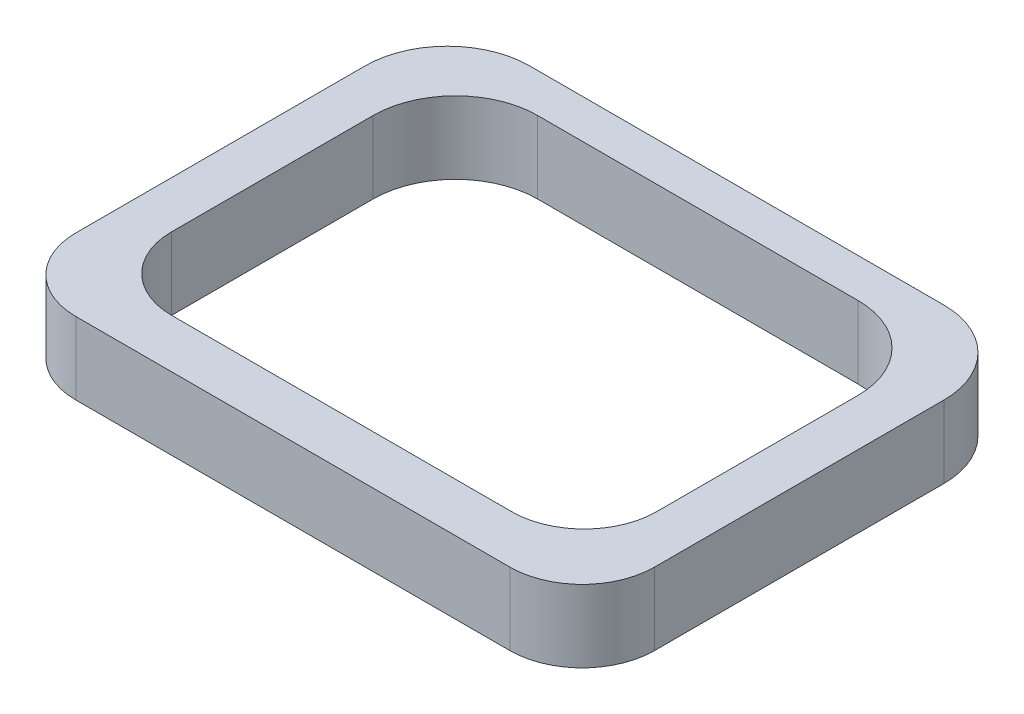
from build123d import *

# Parameters (mm, degrees)
BOSS_EXTRUDE2_DEPTH = 30


with BuildPart() as part:
    # Sketch1 → Boss-Extrude2 (new body)
    with BuildSketch(Plane(origin=(0, 0, 0), x_dir=(1, 0, 0), z_dir=(0, 1, 0))):
        with BuildLine():
            Line((-85.9, 92.05), (85.9, 92.05))
            ThreePointArc((85.9, 92.05), (110.012341238, 82.062341238), (120, 57.95))
            Line((120, 57.95), (120, -62.05))
            ThreePointArc((120, -62.05), (111.213203436, -83.263203436), (90, -92.05))
            Line((90, -92.05), (-90, -92.05))
            ThreePointArc((-90, -92.05), (-111.213203436, -83.263203436), (-120, -62.05))
            Line((-120, -62.05), (-120, 57.95))
            ThreePointArc((-120, 57.95), (-110.012341238, 82.062341238), (-85.9, 92.05))
        make_face()
        with BuildLine():
            Line((-66.42766953, 75.880339059), (66.42766953, 75.880339059))
            ThreePointArc((66.42766953, 75.880339059), (90.540010768, 65.892680298), (100.52766953, 41.780339059))
            Line((100.52766953, 41.780339059), (100.52766953, -41.780339059))
            ThreePointArc((100.52766953, -41.780339059), (91.740872965, -62.993542495), (70.52766953, -71.780339059))
            Line((70.52766953, -71.780339059), (-70.52766953, -71.780339059))
            ThreePointArc((-70.52766953, -71.780339059), (-91.740872965, -62.993542495), (-100.52766953, -41.780339059))
            Line((-100.52766953, -41.780339059), (-100.52766953, 41.780339059))
            ThreePointArc((-100.52766953, 41.780339059), (-90.540010768, 65.892680298), (-66.42766953, 75.880339059))
        make_face(mode=Mode.SUBTRACT)
    extrude(amount=BOSS_EXTRUDE2_DEPTH)


solid = part.part
